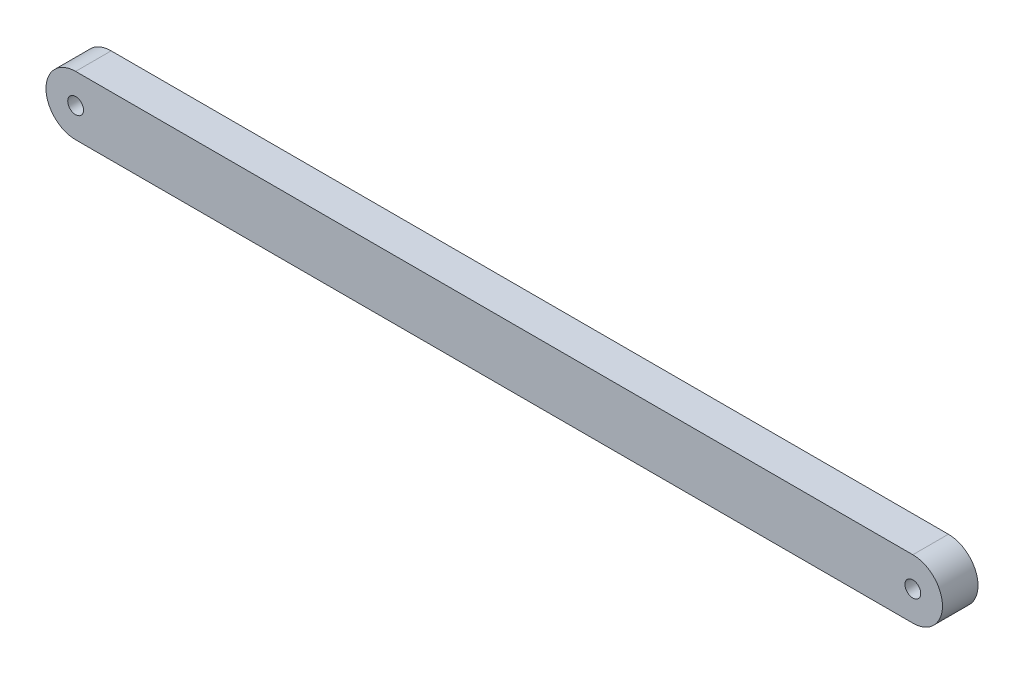
from build123d import *

# Parameters (mm, degrees)
SKETCH_1_R      = 4
EXTRUDE_2_DEPTH = 18


with BuildPart() as part:
    # 草图1 → 凸台-拉伸2 (new body)
    with BuildSketch(Plane.XY):
        with BuildLine():
            Line((0, 15), (423.93, 15))
            ThreePointArc((423.93, 15), (438.93, 0), (423.93, -15))
            Line((423.93, -15), (0, -15))
            ThreePointArc((0, -15), (-15, 0), (0, 15))
        make_face()
        Circle(SKETCH_1_R, mode=Mode.SUBTRACT)
        with Locations((423.93, 0)):
            Circle(SKETCH_1_R, mode=Mode.SUBTRACT)
    extrude(amount=EXTRUDE_2_DEPTH)


solid = part.part
